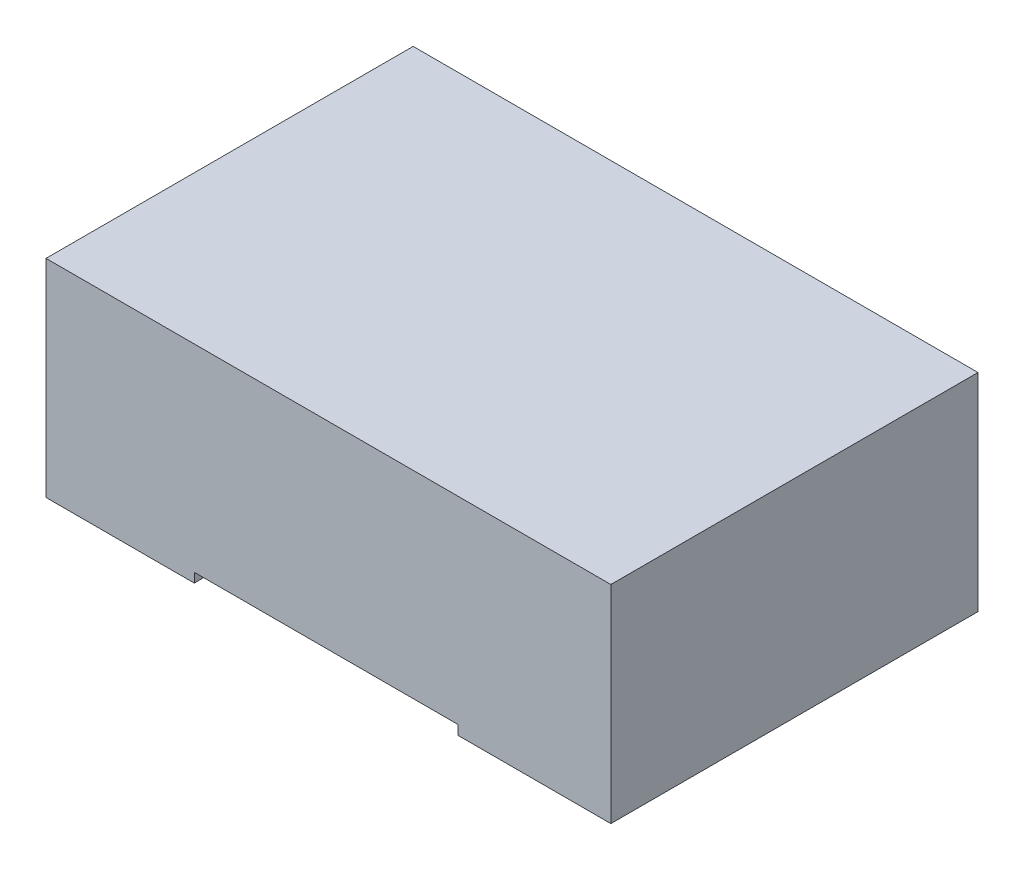
from build123d import *
from OCP.BRepFilletAPI import BRepFilletAPI_MakeChamfer

# Parameters (mm, degrees)
SKETCH1_W           = 60
SKETCH1_H           = 45
BOSS_EXTRUDE1_DEPTH = 30
SKETCH2_W           = 6.5
SKETCH2_H           = 16
CUT_EXTRUDE1_DEPTH  = 20
CHAMFER1_SIZE       = 5
CHAMFER1_SIZE2      = 0.437443318
CHAMFER2_SIZE       = 5
CHAMFER2_SIZE2      = 5.958767963
CUT_EXTRUDE2_DEPTH  = 10
CHAMFER3_SIZE       = 3
CHAMFER3_SIZE2      = 1.5
CUT_EXTRUDE3_REACH  = 82.777
SKETCH6_W           = 28
SKETCH6_H           = 31
CUT_EXTRUDE4_DEPTH  = 1


with BuildPart() as part:
    # Sketch1 → Boss-Extrude1 (new body)
    with BuildSketch(Plane(origin=(0, 0, 0), x_dir=(1, 0, 0), z_dir=(0, 1, 0))):
        with Locations((-30, 22.5)):
            Rectangle(SKETCH1_W, SKETCH1_H)
    extrude(amount=BOSS_EXTRUDE1_DEPTH)

    # Sketch2 → Cut-Extrude1 (cut)
    with BuildSketch(Plane(origin=(0, 0, 0), x_dir=(-1, 0, 0), z_dir=(0, -1, 0))):
        with Locations((47.5, 21)):
            Rectangle(SKETCH2_W, SKETCH2_H)
        with Locations((13, 21)):
            Rectangle(SKETCH2_W, SKETCH2_H)
    extrude(amount=-CUT_EXTRUDE1_DEPTH, mode=Mode.SUBTRACT)

    # Chamfer1: one chamfer whose edges measure the first distance from different faces: ONE call of the kernel's chamfer builder (chamfer() names one face for all edges)
    chamfer1_edges_1 = [part.edges().sort_by_distance(p)[0] for p in [
        (-50.75, 20, -21),
    ]]
    chamfer1_side_1 = [part.faces().sort_by_distance(p)[0] for p in [
        (-50.75, 10, -21),
    ]]
    chamfer1_edges_2 = [part.edges().sort_by_distance(p)[0] for p in [
        (-44.25, 20, -21),
    ]]
    chamfer1_side_2 = [part.faces().sort_by_distance(p)[0] for p in [
        (-44.25, 10, -21),
    ]]
    chamfer1_edges_3 = [part.edges().sort_by_distance(p)[0] for p in [
        (-16.25, 20, -21),
    ]]
    chamfer1_side_3 = [part.faces().sort_by_distance(p)[0] for p in [
        (-16.25, 10, -21),
    ]]
    chamfer1_edges_4 = [part.edges().sort_by_distance(p)[0] for p in [
        (-9.75, 20, -21),
    ]]
    chamfer1_side_4 = [part.faces().sort_by_distance(p)[0] for p in [
        (-9.75, 10, -21),
    ]]
    chamfer1 = BRepFilletAPI_MakeChamfer(part.part.solid().wrapped)
    for e in chamfer1_edges_1:
        chamfer1.Add(CHAMFER1_SIZE, CHAMFER1_SIZE2, e.wrapped, chamfer1_side_1[0].wrapped)  # the first distance lies on this face
    for e in chamfer1_edges_2:
        chamfer1.Add(CHAMFER1_SIZE, CHAMFER1_SIZE2, e.wrapped, chamfer1_side_2[0].wrapped)  # the first distance lies on this face
    for e in chamfer1_edges_3:
        chamfer1.Add(CHAMFER1_SIZE, CHAMFER1_SIZE2, e.wrapped, chamfer1_side_3[0].wrapped)  # the first distance lies on this face
    for e in chamfer1_edges_4:
        chamfer1.Add(CHAMFER1_SIZE, CHAMFER1_SIZE2, e.wrapped, chamfer1_side_4[0].wrapped)  # the first distance lies on this face
    add(Compound.cast(chamfer1.Shape()), mode=Mode.REPLACE)

    # Chamfer2: one chamfer whose edges measure the first distance from different faces: ONE call of the kernel's chamfer builder (chamfer() names one face for all edges)
    chamfer2_edges_1 = [part.edges().sort_by_distance(p)[0] for p in [
        (-47.5, 20, -29),
    ]]
    chamfer2_side_1 = [part.faces().sort_by_distance(p)[0] for p in [
        (-47.5, 9.857394508, -29),
    ]]
    chamfer2_edges_2 = [part.edges().sort_by_distance(p)[0] for p in [
        (-13, 20, -29),
    ]]
    chamfer2_side_2 = [part.faces().sort_by_distance(p)[0] for p in [
        (-13, 9.857394508, -29),
    ]]
    chamfer2_edges_3 = [part.edges().sort_by_distance(p)[0] for p in [
        (-13, 20, -13),
    ]]
    chamfer2_side_3 = [part.faces().sort_by_distance(p)[0] for p in [
        (-13, 9.857394508, -13),
    ]]
    chamfer2_edges_4 = [part.edges().sort_by_distance(p)[0] for p in [
        (-47.5, 20, -13),
    ]]
    chamfer2_side_4 = [part.faces().sort_by_distance(p)[0] for p in [
        (-47.5, 9.857394508, -13),
    ]]
    chamfer2 = BRepFilletAPI_MakeChamfer(part.part.solid().wrapped)
    for e in chamfer2_edges_1:
        chamfer2.Add(CHAMFER2_SIZE, CHAMFER2_SIZE2, e.wrapped, chamfer2_side_1[0].wrapped)  # the first distance lies on this face
    for e in chamfer2_edges_2:
        chamfer2.Add(CHAMFER2_SIZE, CHAMFER2_SIZE2, e.wrapped, chamfer2_side_2[0].wrapped)  # the first distance lies on this face
    for e in chamfer2_edges_3:
        chamfer2.Add(CHAMFER2_SIZE, CHAMFER2_SIZE2, e.wrapped, chamfer2_side_3[0].wrapped)  # the first distance lies on this face
    for e in chamfer2_edges_4:
        chamfer2.Add(CHAMFER2_SIZE, CHAMFER2_SIZE2, e.wrapped, chamfer2_side_4[0].wrapped)  # the first distance lies on this face
    add(Compound.cast(chamfer2.Shape()), mode=Mode.REPLACE)

    # Sketch4 → Cut-Extrude2 (cut)
    with BuildSketch(Plane(origin=(0, 0, -45), x_dir=(-1, 0, 0), z_dir=(0, 0, -1))):
        with BuildLine():
            Line((11.5, 0), (28.3, 0))
            ThreePointArc((28.3, 0), (34.080602383, 6.276082414), (42.61191296, 6.13008847))
            ThreePointArc((42.61191296, 6.13008847), (47.088831578, 7.478397416), (46.230644896, 12.074510224))
            ThreePointArc((46.230644896, 12.074510224), (25.608734298, 15.404376803), (11.5, 0))
        make_face()
    extrude(amount=-CUT_EXTRUDE2_DEPTH, mode=Mode.SUBTRACT)

    # Chamfer3
    chamfer3_edges = [part.edges().sort_by_distance(p)[0] for p in [
        (-50.75, 0, -21),
        (-47.5, 0, -29),
        (-44.25, 0, -21),
        (-47.5, 0, -13),
        (-16.25, 0, -21),
        (-13, 0, -29),
        (-9.75, 0, -21),
        (-13, 0, -13),
    ]]
    chamfer3_side = [part.faces().sort_by_distance(p)[0] for p in [
        (-30.707745267, 0, -21.36919105),
    ]]
    chamfer(chamfer3_edges, length=CHAMFER3_SIZE, length2=CHAMFER3_SIZE2, reference=chamfer3_side[0])

    # Sketch5 → Cut-Extrude3 (cut, up to next)
    with BuildSketch(Plane.ZY.offset(60), mode=Mode.PRIVATE) as cut_extrude3_sk1:
        Polygon((-45, 30), (0, 30), (0, 0), (-6, 0), (-6, 22), (-45, 22), align=None)
    cut_extrude3_tool1 = extrude(cut_extrude3_sk1.sketch, amount=-CUT_EXTRUDE3_REACH, mode=Mode.PRIVATE) & part.part
    add(cut_extrude3_tool1.solids().sort_by_distance((-60, 29.459167, -22.5))[0], mode=Mode.SUBTRACT)

    # Sketch6 → Cut-Extrude4 (cut)
    with BuildSketch(Plane(origin=(0, 0, 0), x_dir=(-1, 0, 0), z_dir=(0, -1, 0))):
        with Locations((30.25, 21.5)):
            Rectangle(SKETCH6_W, SKETCH6_H)
    extrude(amount=-CUT_EXTRUDE4_DEPTH, mode=Mode.SUBTRACT)


solid = part.part
